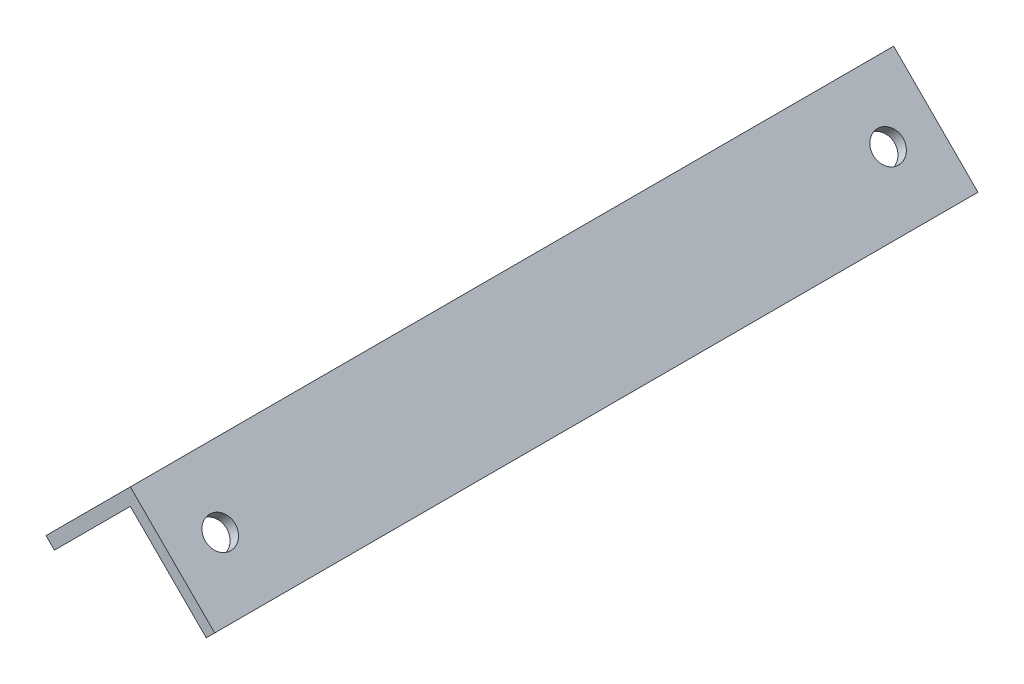
from build123d import *

# Parameters (mm, degrees)
BOSS_EXTRUDE1_DEPTH     = 203.2
SKETCH4_R               = 3.9751
CUT_EXTRUDE3_DEPTH      = 210.309331493
ESQUISSE1_R             = 3.9751
ENL_V_MAT_EXTRU_1_DEPTH = 206.922677388


with BuildPart() as part:
    # Sketch1 → Boss-Extrude1 (new body)
    with BuildSketch(Plane.XY):
        Polygon((0, 0), (22.450640303, 22.450640303), (44.901280605, 0), (42.656216575, -2.24506403), (22.450640303, 17.960512242), (2.24506403, -2.24506403), align=None)
    extrude(amount=BOSS_EXTRUDE1_DEPTH)

    # Sketch4 → Cut-Extrude3 (cut, through all)
    with BuildSketch(Plane(origin=(0, 0, 0), x_dir=(0, 0, 1), z_dir=(-0.7071067811865476, 0.7071067811865475, 0))):
        with Locations(Location((31.75, 15.875, 0), (0, 0, 270))):
            Circle(SKETCH4_R)
        with Locations(Location((171.45, 15.875, 0), (0, 0, 270))):
            Circle(SKETCH4_R)
    extrude(amount=-CUT_EXTRUDE3_DEPTH, mode=Mode.SUBTRACT)

    # Esquisse1 → Enlèv. mat.-Extru.1 (cut, through all)
    with BuildSketch(Plane(origin=(22.450640303, 22.450640303, 0), x_dir=(-0.7071067811865476, 0.7071067811865475, 0), z_dir=(0.7071067811865475, 0.7071067811865476, 0))):
        with Locations((-15.875, 12.7)):
            Circle(ESQUISSE1_R)
    enl_v_mat_extru_1 = extrude(amount=-ENL_V_MAT_EXTRU_1_DEPTH, mode=Mode.SUBTRACT)

    # Symétrie1: Enlèv. mat.-Extru.1 across plane
    add(enl_v_mat_extru_1.mirror(Plane.XY.offset(101.6)), mode=Mode.SUBTRACT)


solid = part.part
